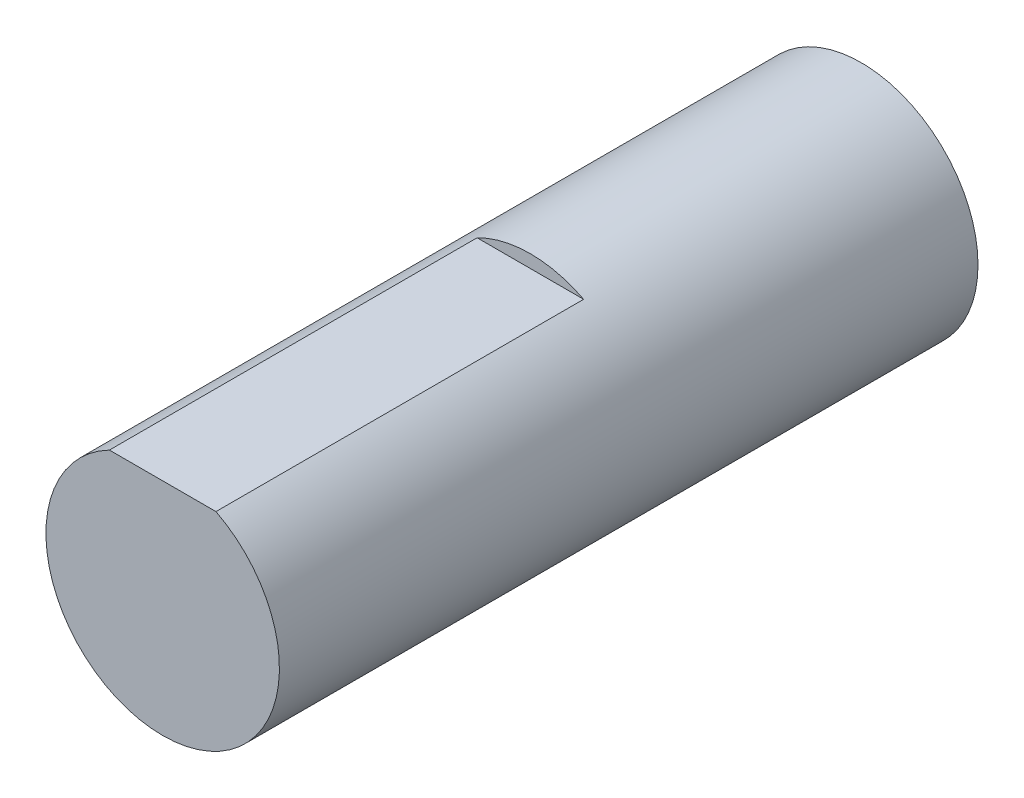
from build123d import *

# Parameters (mm, degrees)
SKETCH1_R           = 3.175
BOSS_EXTRUDE1_DEPTH = 19
SKETCH2_W           = 2.89827535
SKETCH2_H           = 0.35
CUT_EXTRUDE1_DEPTH  = 10


with BuildPart() as part:
    # Sketch1 → Boss-Extrude1 (new body)
    with BuildSketch(Plane.XY):
        Circle(SKETCH1_R)
    extrude(amount=BOSS_EXTRUDE1_DEPTH)

    # Sketch2 → Cut-Extrude1 (cut)
    with BuildSketch(Plane.XY.offset(19)):
        with Locations((0, 3)):
            Rectangle(SKETCH2_W, SKETCH2_H)
    extrude(amount=-CUT_EXTRUDE1_DEPTH, mode=Mode.SUBTRACT)


solid = part.part
